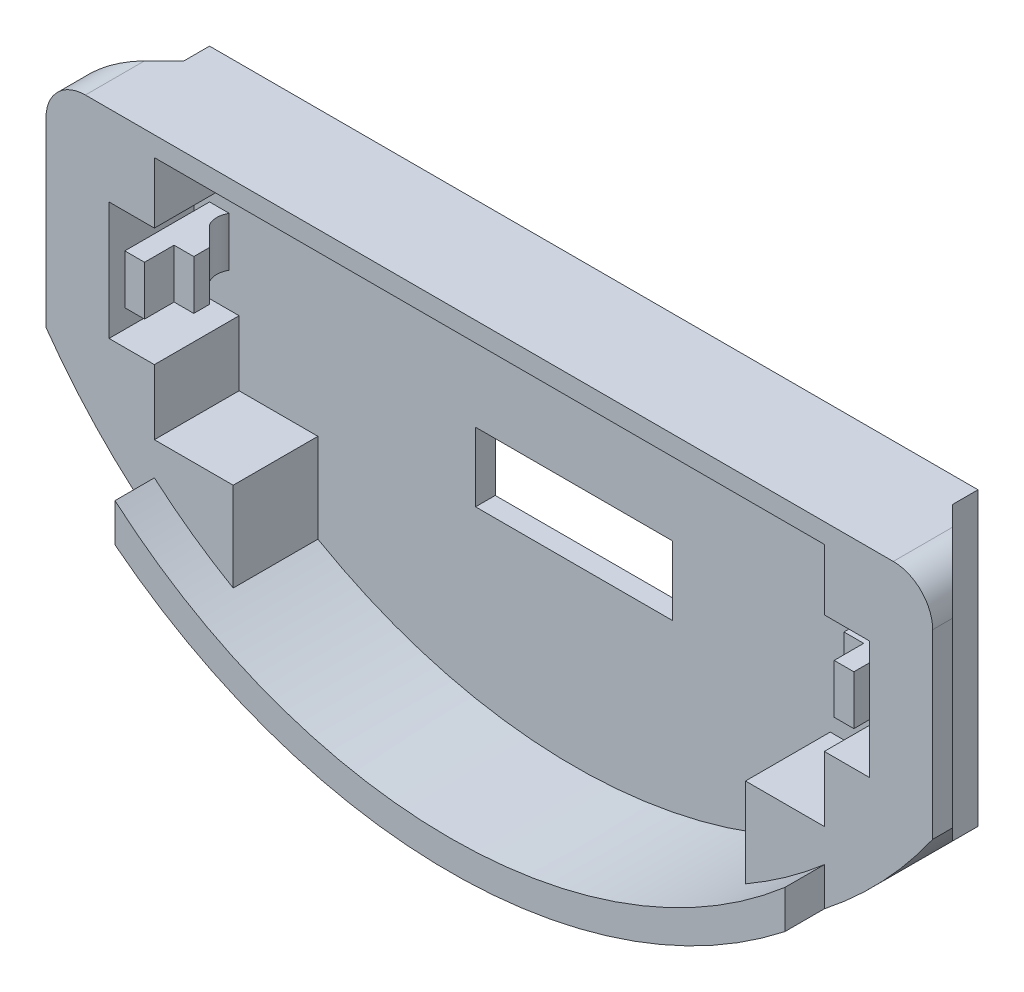
from build123d import *

# Parameters (mm, degrees)
SKETCH1_W           = 1
SKETCH1_H           = 2.5
SKETCH1_W_2         = 10
SKETCH1_H_2         = 3.5
BOSS_EXTRUDE1_DEPTH = 1
BOSS_EXTRUDE2_START = 4.3
SKETCH1_3_W         = 1
SKETCH1_3_H         = 2.5
BOSS_EXTRUDE2_DEPTH = 4.3
CUT_EXTRUDE1_REACH  = 29.14
CUT_EXTRUDE2_DEPTH  = 33.393667716
BOSS_EXTRUDE4_START = 2
BOSS_EXTRUDE4_DEPTH = 2
SKETCH3_5_W         = 1
SKETCH3_5_H         = 0.8
BOSS_EXTRUDE5_DEPTH = 2.5


with BuildPart() as part:
    # Sketch1 → Boss-Extrude1 (new body)
    # profile 1 of 4: a face of its own
    with BuildSketch(Plane(origin=(0, 0, 0), x_dir=(-1, 0, 0), z_dir=(0, 0, 1))):
        with BuildLine():
            ThreePointArc((-20.5, -7.1), (-21.914213562, -6.514213562), (-22.5, -5.1))
            Line((-22.5, -5.1), (-22.5, 4.115748324))
            ThreePointArc((-22.5, 4.115748324), (0, 15.804360023), (22.5, 4.115748324))
            Line((22.5, 4.115748324), (22.5, -5.1))
            ThreePointArc((22.5, -5.1), (21.914213562, -6.514213562), (20.5, -7.1))
            Line((20.5, -7.1), (-20.5, -7.1))
        make_face()
        with BuildLine():
            Line((-13, 6.3), (-13, 10.821020521))
            ThreePointArc((-13, 10.821020521), (0, 14.304360023), (13, 10.821020521))
            Line((13, 10.821020521), (13, 6.3))
            Line((13, 6.3), (17, 6.3))
            Line((17, 6.3), (17, 3))
            Line((17, 3), (19.3, 3))
            Line((19.3, 3), (19.3, -3))
            Line((19.3, -3), (17, -3))
            Line((17, -3), (17, -6.1))
            Line((17, -6.1), (-17, -6.1))
            Line((-17, -6.1), (-17, -3))
            Line((-17, -3), (-19.3, -3))
            Line((-19.3, -3), (-19.3, 3))
            Line((-19.3, 3), (-17, 3))
            Line((-17, 3), (-17, 6.3))
            Line((-17, 6.3), (-13, 6.3))
        make_face(mode=Mode.SUBTRACT)
    # profile 2 of 4: a face of its own
    with BuildSketch(Plane(origin=(0, 0, 0), x_dir=(-1, 0, 0), z_dir=(0, 0, 1))):
        with BuildLine():
            ThreePointArc((-13, 10.821020521), (0, 14.304360023), (13, 10.821020521))
            Line((13, 10.821020521), (13, 6.3))
            Line((13, 6.3), (17, 6.3))
            Line((17, 6.3), (17, 3))
            Line((17, 3), (19.3, 3))
            Line((19.3, 3), (19.3, -3))
            Line((19.3, -3), (17, -3))
            Line((17, -3), (17, -6.1))
            Line((17, -6.1), (-17, -6.1))
            Line((-17, -6.1), (-17, -3))
            Line((-17, -3), (-19.3, -3))
            Line((-19.3, -3), (-19.3, 3))
            Line((-19.3, 3), (-17, 3))
            Line((-17, 3), (-17, 6.3))
            Line((-17, 6.3), (-13, 6.3))
            Line((-13, 6.3), (-13, 10.821020521))
        make_face()
        with Locations((-18, 0)):
            Rectangle(SKETCH1_W, SKETCH1_H, mode=Mode.SUBTRACT)
        with Locations((0, 3.65)):
            Rectangle(SKETCH1_W_2, SKETCH1_H_2, mode=Mode.SUBTRACT)
        with Locations((18, 0)):
            Rectangle(SKETCH1_W, SKETCH1_H, mode=Mode.SUBTRACT)
    # profile 3 of 4: a face of its own
    with BuildSketch(Plane(origin=(0, 0, 0), x_dir=(-1, 0, 0), z_dir=(0, 0, 1))):
        with Locations((18, 0)):
            Rectangle(SKETCH1_W, SKETCH1_H)
    # profile 4 of 4: a face of its own
    with BuildSketch(Plane(origin=(0, 0, 0), x_dir=(-1, 0, 0), z_dir=(0, 0, 1))):
        with Locations((-18, 0)):
            Rectangle(SKETCH1_W, SKETCH1_H)
    extrude(amount=-BOSS_EXTRUDE1_DEPTH)

    # Sketch1<3> → Boss-Extrude2 (add)
    # profile 1 of 3: a face of its own
    with BuildSketch(Plane(origin=(0, 0, 0), x_dir=(-1, 0, 0), z_dir=(0, 0, 1)).offset(BOSS_EXTRUDE2_START)):
        with BuildLine():
            ThreePointArc((-20.5, -7.1), (-21.914213562, -6.514213562), (-22.5, -5.1))
            Line((-22.5, -5.1), (-22.5, 4.115748324))
            ThreePointArc((-22.5, 4.115748324), (0, 15.804360023), (22.5, 4.115748324))
            Line((22.5, 4.115748324), (22.5, -5.1))
            ThreePointArc((22.5, -5.1), (21.914213562, -6.514213562), (20.5, -7.1))
            Line((20.5, -7.1), (-20.5, -7.1))
        make_face()
        with BuildLine():
            Line((-13, 6.3), (-13, 10.821020521))
            ThreePointArc((-13, 10.821020521), (0, 14.304360023), (13, 10.821020521))
            Line((13, 10.821020521), (13, 6.3))
            Line((13, 6.3), (17, 6.3))
            Line((17, 6.3), (17, 3))
            Line((17, 3), (19.3, 3))
            Line((19.3, 3), (19.3, -3))
            Line((19.3, -3), (17, -3))
            Line((17, -3), (17, -6.1))
            Line((17, -6.1), (-17, -6.1))
            Line((-17, -6.1), (-17, -3))
            Line((-17, -3), (-19.3, -3))
            Line((-19.3, -3), (-19.3, 3))
            Line((-19.3, 3), (-17, 3))
            Line((-17, 3), (-17, 6.3))
            Line((-17, 6.3), (-13, 6.3))
        make_face(mode=Mode.SUBTRACT)
    # profile 2 of 3: a face of its own
    with BuildSketch(Plane(origin=(0, 0, 0), x_dir=(-1, 0, 0), z_dir=(0, 0, 1)).offset(BOSS_EXTRUDE2_START)):
        with Locations((18, 0)):
            Rectangle(SKETCH1_3_W, SKETCH1_3_H)
    # profile 3 of 3: a face of its own
    with BuildSketch(Plane(origin=(0, 0, 0), x_dir=(-1, 0, 0), z_dir=(0, 0, 1)).offset(BOSS_EXTRUDE2_START)):
        with Locations((-18, 0)):
            Rectangle(SKETCH1_3_W, SKETCH1_3_H)
    extrude(amount=-BOSS_EXTRUDE2_DEPTH)

    # Sketch3 → Cut-Extrude1 (cut, up to next)
    with BuildSketch(Plane.XZ.offset(1.25), mode=Mode.PRIVATE) as cut_extrude1_sk1:
        with BuildLine():
            Line((-17.5, 0), (-17.5, 1))
            ThreePointArc((-17.5, 1), (-17.633974596, 0.5), (-17.5, 0))
        make_face()
    cut_extrude1_tool1 = extrude(cut_extrude1_sk1.sketch, amount=-CUT_EXTRUDE1_REACH, mode=Mode.PRIVATE) & part.part
    # Sketch3 → Cut-Extrude1 (cut, up to next)
    with BuildSketch(Plane.XZ.offset(1.25), mode=Mode.PRIVATE) as cut_extrude1_sk2:
        with BuildLine():
            ThreePointArc((17.5, 0), (17.633974596, 0.5), (17.5, 1))
            Line((17.5, 1), (17.5, 0))
        make_face()
    cut_extrude1_tool2 = extrude(cut_extrude1_sk2.sketch, amount=-CUT_EXTRUDE1_REACH, mode=Mode.PRIVATE) & part.part
    add(cut_extrude1_tool1.solids().sort_by_distance((-17.55391, -1.25, 0.5))[0], mode=Mode.SUBTRACT)
    add(cut_extrude1_tool2.solids().sort_by_distance((17.55391, -1.25, 0.5))[0], mode=Mode.SUBTRACT)

    # Sketch4 → Cut-Extrude2 (cut, through all)
    with BuildSketch(Plane(origin=(0, 7.1, 0), x_dir=(1, 0, 0), z_dir=(0, 1, 0))):
        Polygon((19.5, 1), (19.5, -0.3), (22.5, -3.3), (22.5, 1), align=None)
        Polygon((-19.5, -0.3), (-22.5, -3.3), (-22.5, 1), (-19.5, 1), align=None)
    extrude(amount=-CUT_EXTRUDE2_DEPTH, mode=Mode.SUBTRACT)

    # Sketch5 → Boss-Extrude4 (add)
    with BuildSketch(Plane.XY.offset(4.3).offset(BOSS_EXTRUDE4_START)):
        with BuildLine():
            Line((17, -7.976675596), (17, -9.920326344))
            ThreePointArc((17, -9.920326344), (0, -15.804360023), (-17, -9.920326344))
            Line((-17, -9.920326344), (-17, -7.976675596))
            ThreePointArc((-17, -7.976675596), (0, -14.304360023), (17, -7.976675596))
        make_face()
    extrude(amount=-BOSS_EXTRUDE4_DEPTH)

    # Sketch3<5> → Boss-Extrude5 (add)
    with BuildSketch(Plane.XZ.offset(1.25)):
        with Locations((17, 2.4)):
            Rectangle(SKETCH3_5_W, SKETCH3_5_H)
        Polygon((16.5, 2), (17.5, 2), (17.5, 1), align=None)
        with Locations((-17, 2.4)):
            Rectangle(SKETCH3_5_W, SKETCH3_5_H)
        Polygon((-16.5, 2), (-17.5, 2), (-17.5, 1), align=None)
    extrude(amount=-BOSS_EXTRUDE5_DEPTH)


solid = part.part
